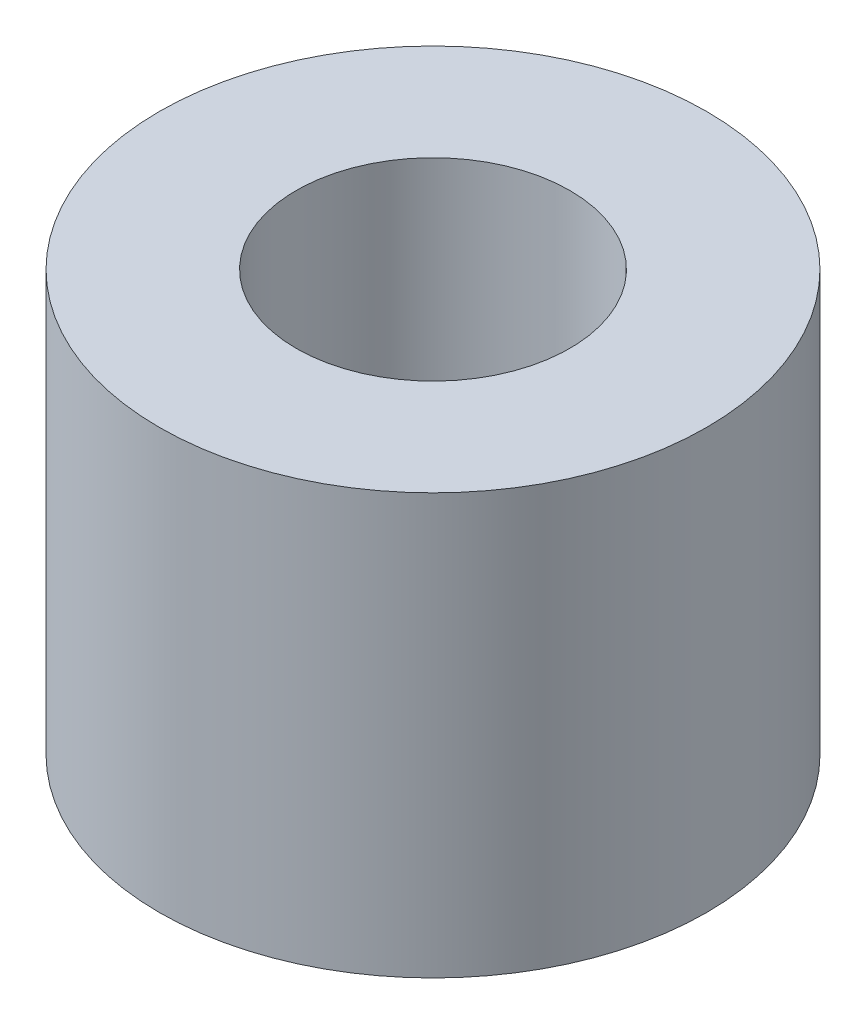
from build123d import *

# Parameters (mm, degrees)
SKETCH2_R           = 6.35
SKETCH2_R_2         = 3.175
BOSS_EXTRUDE1_DEPTH = 9.75


with BuildPart() as part:
    # Sketch2 → Boss-Extrude1 (new body)
    with BuildSketch(Plane(origin=(0, 0, 0), x_dir=(1, 0, 0), z_dir=(0, 1, 0))):
        with Locations(Location((0, 0, 0), (0, 0, 270))):
            Circle(SKETCH2_R)
        with Locations(Location((0, 0, 0), (0, 0, 270))):
            Circle(SKETCH2_R_2, mode=Mode.SUBTRACT)
    extrude(amount=BOSS_EXTRUDE1_DEPTH)


solid = part.part
